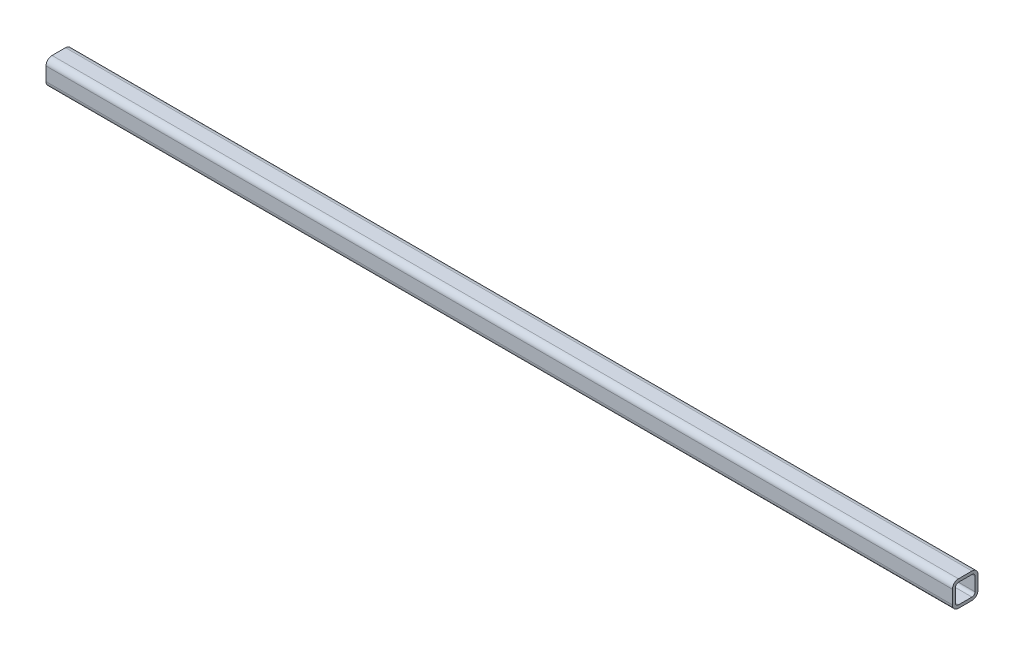
from build123d import *

# Parameters (mm, degrees)
TUBO_CUADRADO_2_X_2_X_0_25_1_DEPTH = 900


with BuildPart() as part:
    # Sketch1 → Tubo cuadrado 2 X 2 X 0.25(1) (new body)
    with BuildSketch(Plane(origin=(0, 0, 0), x_dir=(0, 0, -1), z_dir=(1, 0, 0))):
        with BuildLine():
            Line((-6.7, -12.7), (6.7, -12.7))
            ThreePointArc((6.7, -12.7), (10.942640687, -10.942640687), (12.7, -6.7))
            Line((12.7, -6.7), (12.7, 6.7))
            ThreePointArc((12.7, 6.7), (10.942640687, 10.942640687), (6.7, 12.7))
            Line((6.7, 12.7), (-6.7, 12.7))
            ThreePointArc((-6.7, 12.7), (-10.942640687, 10.942640687), (-12.7, 6.7))
            Line((-12.7, 6.7), (-12.7, -6.7))
            ThreePointArc((-12.7, -6.7), (-10.942640687, -10.942640687), (-6.7, -12.7))
        make_face()
        with BuildLine():
            Line((-6.7, -9.7), (6.7, -9.7))
            ThreePointArc((6.7, -9.7), (8.821320344, -8.821320344), (9.7, -6.7))
            Line((9.7, -6.7), (9.7, 6.7))
            ThreePointArc((9.7, 6.7), (8.821320344, 8.821320344), (6.7, 9.7))
            Line((6.7, 9.7), (-6.7, 9.7))
            ThreePointArc((-6.7, 9.7), (-8.821320344, 8.821320344), (-9.7, 6.7))
            Line((-9.7, 6.7), (-9.7, -6.7))
            ThreePointArc((-9.7, -6.7), (-8.821320344, -8.821320344), (-6.7, -9.7))
        make_face(mode=Mode.SUBTRACT)
    extrude(amount=TUBO_CUADRADO_2_X_2_X_0_25_1_DEPTH)


solid = part.part
